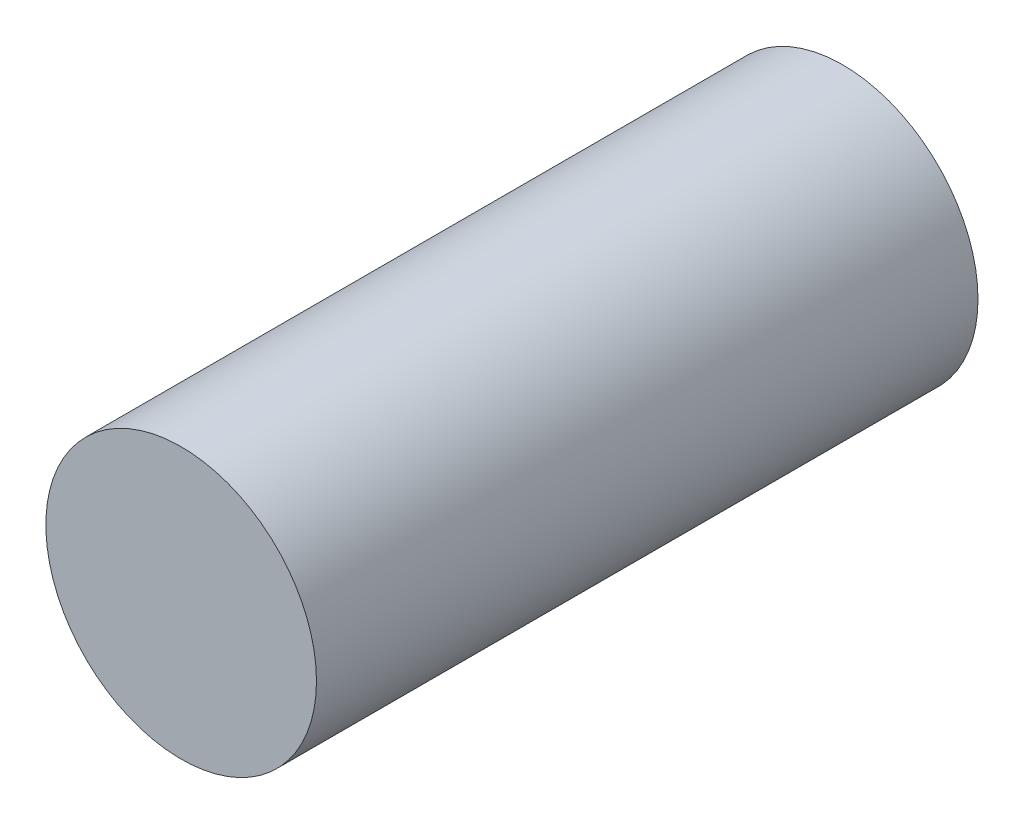
from build123d import *

# Parameters (mm, degrees)
SKETCH1_R           = 4.5
BOSS_EXTRUDE1_DEPTH = 22


with BuildPart() as part:
    # Sketch1 → Boss-Extrude1 (new body)
    with BuildSketch(Plane.XY):
        Circle(SKETCH1_R)
    extrude(amount=BOSS_EXTRUDE1_DEPTH)


solid = part.part
